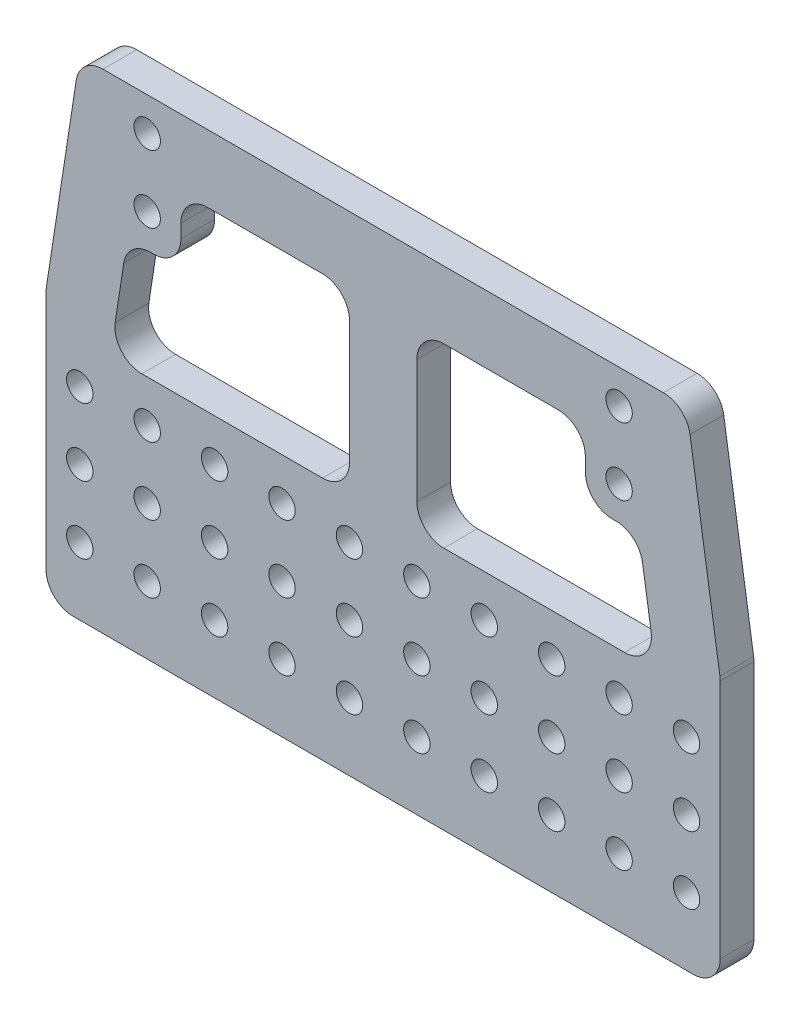
from build123d import *

# Parameters (mm, degrees)
SKETCH1_R           = 2.4892
BOSS_EXTRUDE1_DEPTH = 3.175
CUT_EXTRUDE1_DEPTH  = 113.028470154
FILLET1_R           = 5.08


with BuildPart() as part:
    # Sketch1 → Boss-Extrude1 (new, symmetric)
    with BuildSketch(Plane.XY):
        Polygon((-57.15, 92.075), (57.15, 92.075), (63.5, 50.8), (63.5, 0), (-63.5, 0), (-63.5, 50.8), align=None)
        with Locations((44.45, 73.025)):
            Circle(SKETCH1_R, mode=Mode.SUBTRACT)
        with Locations((44.45, 85.725)):
            Circle(SKETCH1_R, mode=Mode.SUBTRACT)
        with Locations(Location((-44.45, 73.025, 0), (0, 0, 180))):
            Circle(SKETCH1_R, mode=Mode.SUBTRACT)
        with Locations(Location((-44.45, 85.725, 0), (0, 0, 180))):
            Circle(SKETCH1_R, mode=Mode.SUBTRACT)
        with Locations((6.35, 12.7)):
            Circle(SKETCH1_R, mode=Mode.SUBTRACT)
        with Locations((6.35, 25.4)):
            Circle(SKETCH1_R, mode=Mode.SUBTRACT)
        with Locations((6.35, 38.1)):
            Circle(SKETCH1_R, mode=Mode.SUBTRACT)
        with Locations((19.05, 38.1)):
            Circle(SKETCH1_R, mode=Mode.SUBTRACT)
        with Locations((19.05, 25.4)):
            Circle(SKETCH1_R, mode=Mode.SUBTRACT)
        with Locations((19.05, 12.7)):
            Circle(SKETCH1_R, mode=Mode.SUBTRACT)
        with Locations((31.75, 38.1)):
            Circle(SKETCH1_R, mode=Mode.SUBTRACT)
        with Locations((31.75, 25.4)):
            Circle(SKETCH1_R, mode=Mode.SUBTRACT)
        with Locations((31.75, 12.7)):
            Circle(SKETCH1_R, mode=Mode.SUBTRACT)
        with Locations((44.45, 38.1)):
            Circle(SKETCH1_R, mode=Mode.SUBTRACT)
        with Locations((44.45, 25.4)):
            Circle(SKETCH1_R, mode=Mode.SUBTRACT)
        with Locations((44.45, 12.7)):
            Circle(SKETCH1_R, mode=Mode.SUBTRACT)
        with Locations((-6.35, 12.7)):
            Circle(SKETCH1_R, mode=Mode.SUBTRACT)
        with Locations((-6.35, 25.4)):
            Circle(SKETCH1_R, mode=Mode.SUBTRACT)
        with Locations((-6.35, 38.1)):
            Circle(SKETCH1_R, mode=Mode.SUBTRACT)
        with Locations((-19.05, 12.7)):
            Circle(SKETCH1_R, mode=Mode.SUBTRACT)
        with Locations((-19.05, 25.4)):
            Circle(SKETCH1_R, mode=Mode.SUBTRACT)
        with Locations((-19.05, 38.1)):
            Circle(SKETCH1_R, mode=Mode.SUBTRACT)
        with Locations((-31.75, 12.7)):
            Circle(SKETCH1_R, mode=Mode.SUBTRACT)
        with Locations((-31.75, 25.4)):
            Circle(SKETCH1_R, mode=Mode.SUBTRACT)
        with Locations((-31.75, 38.1)):
            Circle(SKETCH1_R, mode=Mode.SUBTRACT)
        with Locations((-44.45, 12.7)):
            Circle(SKETCH1_R, mode=Mode.SUBTRACT)
        with Locations((-44.45, 25.4)):
            Circle(SKETCH1_R, mode=Mode.SUBTRACT)
        with Locations((-44.45, 38.1)):
            Circle(SKETCH1_R, mode=Mode.SUBTRACT)
        with Locations((57.15, 38.1)):
            Circle(SKETCH1_R, mode=Mode.SUBTRACT)
        with Locations((57.15, 25.4)):
            Circle(SKETCH1_R, mode=Mode.SUBTRACT)
        with Locations((57.15, 12.7)):
            Circle(SKETCH1_R, mode=Mode.SUBTRACT)
        with Locations((-57.15, 12.7)):
            Circle(SKETCH1_R, mode=Mode.SUBTRACT)
        with Locations((-57.15, 25.4)):
            Circle(SKETCH1_R, mode=Mode.SUBTRACT)
        with Locations((-57.15, 38.1)):
            Circle(SKETCH1_R, mode=Mode.SUBTRACT)
    extrude(amount=BOSS_EXTRUDE1_DEPTH, both=True)

    # Sketch2 → Cut-Extrude1 (cut, through all)
    with BuildSketch(Plane.XY.offset(3.175)):
        Polygon((-38.1, 79.375), (-6.35, 79.375), (-6.35, 46.0375), (-51.383275403, 46.0375), (-48.208275403, 66.675), (-38.1, 66.675), align=None)
        Polygon((38.1, 79.375), (38.1, 66.675), (48.208275403, 66.675), (51.383275403, 46.0375), (6.35, 46.0375), (6.35, 79.375), align=None)
    extrude(amount=-CUT_EXTRUDE1_DEPTH, mode=Mode.SUBTRACT)

    # Fillet1
    fillet1_edges = [part.edges().sort_by_distance(p)[0] for p in [
        (-57.15, 92.075, 0),
        (57.15, 92.075, 0),
        (63.5, 50.8, 0),
        (63.5, 0, 0),
        (-63.5, 0, 0),
        (-63.5, 50.8, 0),
        (-6.35, 79.375, 0),
        (-6.35, 46.0375, 0),
        (-51.383275403, 46.0375, 0),
        (-48.208275403, 66.675, 0),
        (-38.1, 66.675, 0),
        (-38.1, 79.375, 0),
        (6.35, 79.375, 0),
        (38.1, 79.375, 0),
        (38.1, 66.675, 0),
        (48.208275403, 66.675, 0),
        (51.383275403, 46.0375, 0),
        (6.35, 46.0375, 0),
    ]]
    fillet(fillet1_edges, radius=FILLET1_R)


solid = part.part
